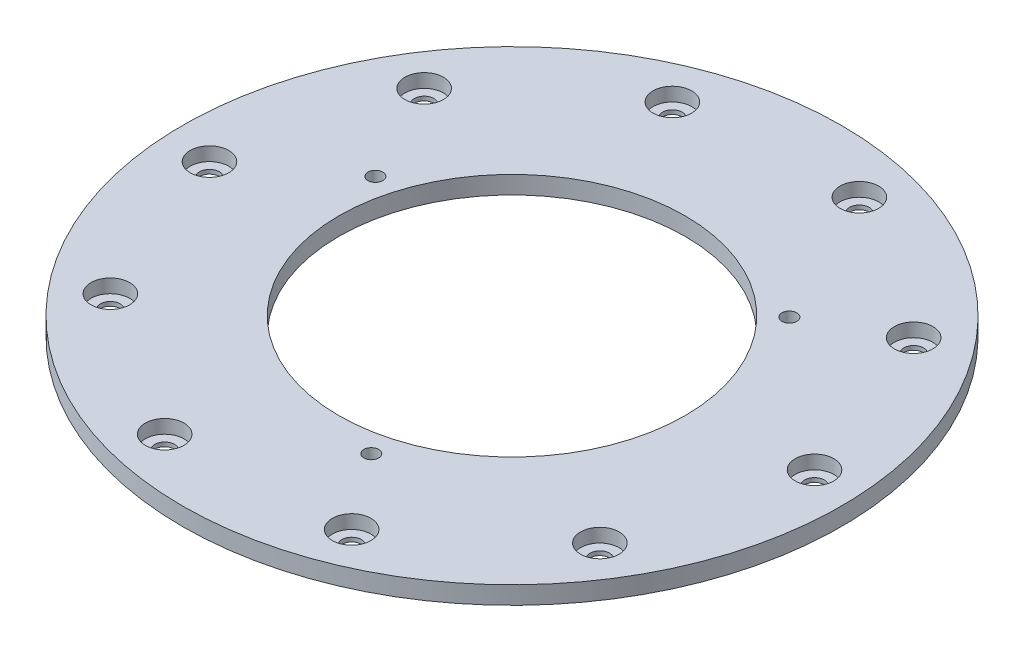
from build123d import *

# Parameters (mm, degrees)
CROQUIS1_R                                           = 110.9
SALIENTE_EXTRUIR1_DEPTH                              = 6
CROQUIS2_R                                           = 58.25
CORTAR_EXTRUIR1_DEPTH                                = 6
REFRENTADO_PARA_TORNILLO_CON_CABEZA_TRON_D           = 6.6
REFRENTADO_PARA_TORNILLO_CON_CABEZA_TRON_CBORE_D     = 13
REFRENTADO_PARA_TORNILLO_CON_CABEZA_TRON_CBORE_DEPTH = 4.6
TALADRO_ROSCADO_M6X1_01_D                            = 5


with BuildPart() as part:
    # Croquis1 → Saliente-Extruir1 (new body)
    with BuildSketch(Plane(origin=(0, 0, 0), x_dir=(1, 0, 0), z_dir=(0, 1, 0))):
        with Locations(Location((0, 0, 0), (0, 0, 270))):
            Circle(CROQUIS1_R)
    extrude(amount=SALIENTE_EXTRUIR1_DEPTH)

    # Croquis2 → Cortar-Extruir1 (cut)
    with BuildSketch(Plane(origin=(0, 6, 0), x_dir=(1, 0, 0), z_dir=(0, 1, 0))):
        with Locations(Location((0, 0, 0), (0, 0, 270))):
            Circle(CROQUIS2_R)
    extrude(amount=-CORTAR_EXTRUIR1_DEPTH, mode=Mode.SUBTRACT)

    # Refrentado para tornillo con cabeza troncocónica de M61 (through all)
    with Locations(Plane(origin=(0, 6, 0), x_dir=(1, 0, 0), z_dir=(0, 1, 0))):
        with Locations((-35.304688321, 89.272498467), (23.910965201, 92.974543522), (73.993442721, 61.16347304), (95.812940065, 5.990034727), (81.035150867, -51.471393258), (35.304688321, -89.272498467), (-23.910965201, -92.974543522), (-73.993442721, -61.16347304), (-95.812940065, -5.990034727), (-81.035150867, 51.471393258), (0, 0)):
            CounterBoreHole(REFRENTADO_PARA_TORNILLO_CON_CABEZA_TRON_D / 2, REFRENTADO_PARA_TORNILLO_CON_CABEZA_TRON_CBORE_D / 2, REFRENTADO_PARA_TORNILLO_CON_CABEZA_TRON_CBORE_DEPTH)

    # Taladro roscado M6x1.01 (through all)
    with Locations(Plane(origin=(0, 6, 0), x_dir=(1, 0, 0), z_dir=(0, 1, 0))):
        with Locations((-63.602274198, 17.628122896), (47.067539348, 46.267123746), (16.53473485, -63.895246642), (0, 0)):
            Hole(TALADRO_ROSCADO_M6X1_01_D / 2)


solid = part.part
